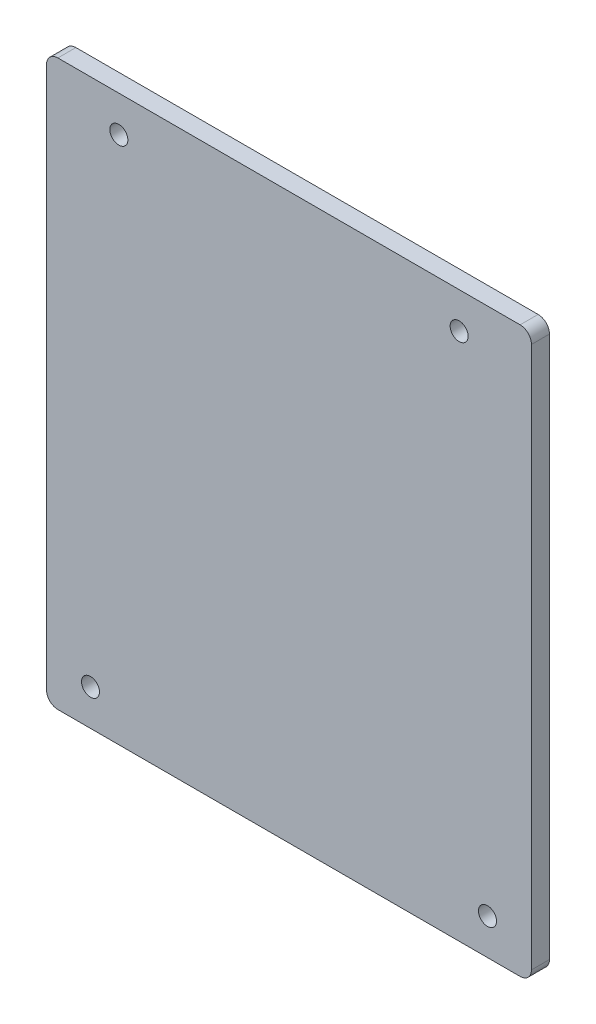
from build123d import *

# Parameters (mm, degrees)
SKETCH1_R           = 1.5875
BOSS_EXTRUDE1_DEPTH = 3.175


with BuildPart() as part:
    # Sketch1 → Boss-Extrude1 (new body)
    with BuildSketch(Plane.XY):
        with BuildLine():
            Line((-40.75, 0), (40.75, 0))
            ThreePointArc((40.75, 0), (42.164213562, -0.585786438), (42.75, -2))
            Line((42.75, -2), (42.75, -97.5))
            ThreePointArc((42.75, -97.5), (42.164213562, -98.914213562), (40.75, -99.5))
            Line((40.75, -99.5), (-40.75, -99.5))
            ThreePointArc((-40.75, -99.5), (-42.164213562, -98.914213562), (-42.75, -97.5))
            Line((-42.75, -97.5), (-42.75, -2))
            ThreePointArc((-42.75, -2), (-42.164213562, -0.585786438), (-40.75, 0))
        make_face()
        with Locations((-30, -6.35)):
            Circle(SKETCH1_R, mode=Mode.SUBTRACT)
        with Locations((30, -6.35)):
            Circle(SKETCH1_R, mode=Mode.SUBTRACT)
        with Locations((35, -93.15)):
            Circle(SKETCH1_R, mode=Mode.SUBTRACT)
        with Locations((-35, -93.15)):
            Circle(SKETCH1_R, mode=Mode.SUBTRACT)
    extrude(amount=BOSS_EXTRUDE1_DEPTH)


solid = part.part
